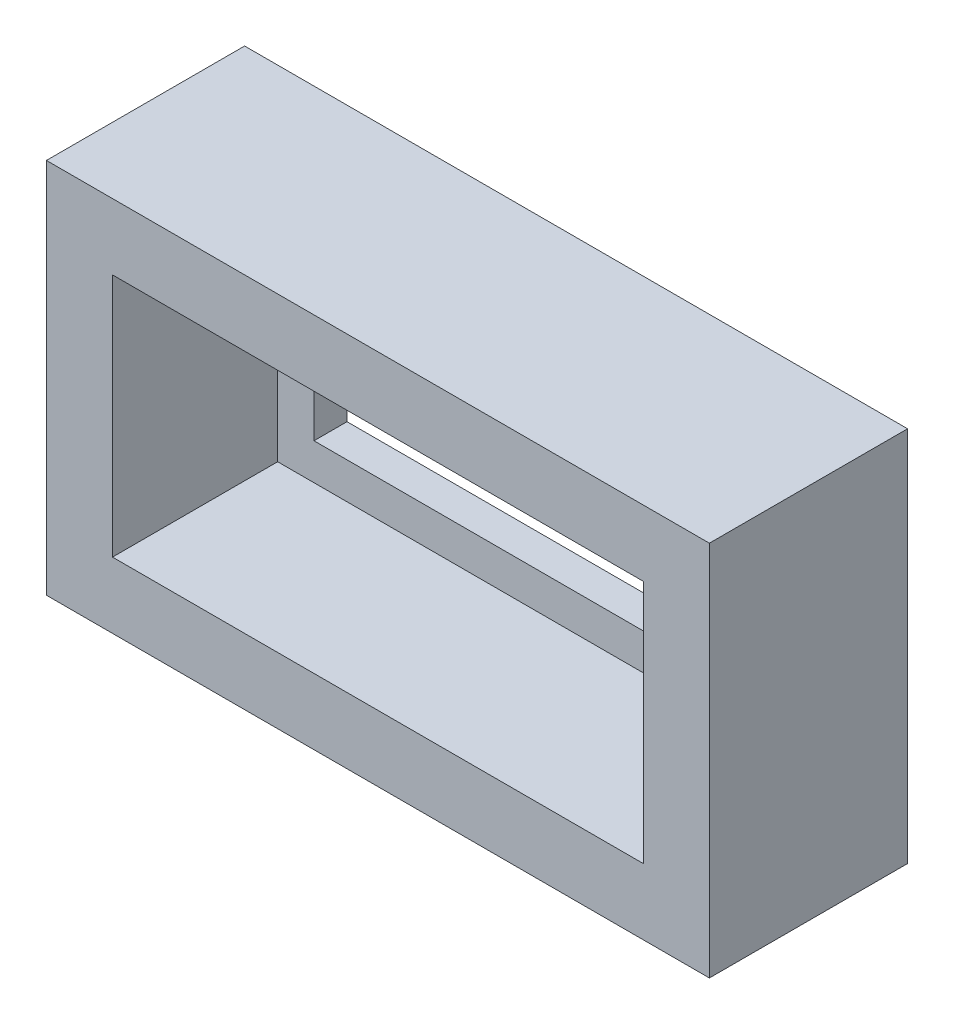
from build123d import *

# Parameters (mm, degrees)
SKETCH1_W           = 20.07
SKETCH1_H           = 11.4
SKETCH1_W_2         = 16.07
SKETCH1_H_2         = 7.4
BOSS_EXTRUDE1_DEPTH = 6
SKETCH2_W           = 16.07
SKETCH2_H           = 7.4
SKETCH2_W_2         = 13.87
SKETCH2_H_2         = 5.2
BOSS_EXTRUDE2_DEPTH = 1
SKETCH3_W           = 1.12
SKETCH3_H           = 0.59
CUT_EXTRUDE1_DEPTH  = 1


with BuildPart() as part:
    # Sketch1 → Boss-Extrude1 (new body)
    with BuildSketch(Plane.XY):
        Rectangle(SKETCH1_W, SKETCH1_H)
        Rectangle(SKETCH1_W_2, SKETCH1_H_2, mode=Mode.SUBTRACT)
    extrude(amount=BOSS_EXTRUDE1_DEPTH)

    # Sketch2 → Boss-Extrude2 (add)
    with BuildSketch(Plane(origin=(0, 0, 0), x_dir=(-1, 0, 0), z_dir=(0, 0, -1))):
        Rectangle(SKETCH2_W, SKETCH2_H)
        Rectangle(SKETCH2_W_2, SKETCH2_H_2, mode=Mode.SUBTRACT)
    extrude(amount=-BOSS_EXTRUDE2_DEPTH)

    # Sketch3 → Cut-Extrude1 (cut)
    with BuildSketch(Plane.XY.offset(1)):
        with Locations((-7.475, 3.405)):
            Rectangle(SKETCH3_W, SKETCH3_H)
        with Locations((7.475, -3.405)):
            Rectangle(SKETCH3_W, SKETCH3_H)
    extrude(amount=-CUT_EXTRUDE1_DEPTH, mode=Mode.SUBTRACT)


solid = part.part
